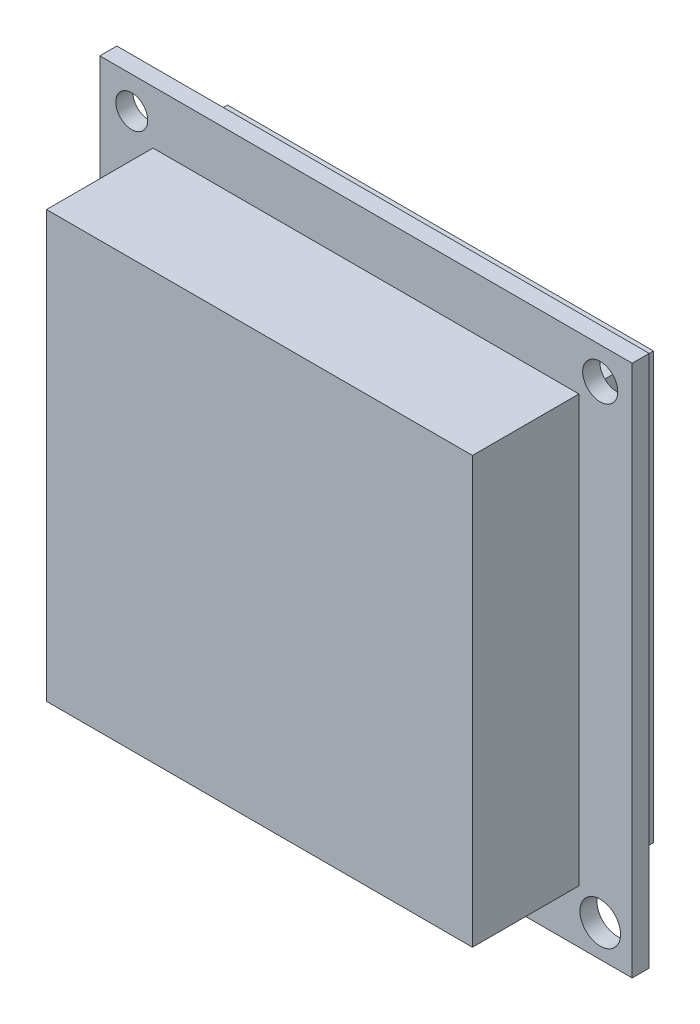
from build123d import *

# Parameters (mm, degrees)
SKETCH1_W           = 50
SKETCH1_H           = 50
SKETCH1_R           = 1.5
SKETCH1_R_2         = 1.646935024
SKETCH1_R_3         = 1.908192471
SKETCH1_R_4         = 1.759080553
EXTRUDE2_DEPTH      = 0.8
EXTRUDE3_DEPTH      = 10
EXTRUDE3_DEPTH_BACK = 7


with BuildPart() as part:
    # Sketch1 → Extrude2 (new, symmetric)
    with BuildSketch(Plane.XY):
        Rectangle(SKETCH1_W, SKETCH1_H)
        with Locations((-22, 22)):
            Circle(SKETCH1_R, mode=Mode.SUBTRACT)
        with Locations((22, 22)):
            Circle(SKETCH1_R_2, mode=Mode.SUBTRACT)
        with Locations((22, -22)):
            Circle(SKETCH1_R_3, mode=Mode.SUBTRACT)
        with Locations((-22, -22)):
            Circle(SKETCH1_R_4, mode=Mode.SUBTRACT)
    extrude(amount=EXTRUDE2_DEPTH, both=True)

    # Sketch2 → Extrude3 (add, two sides: drawn at the far end of the back side and taken through both)
    with BuildSketch(Plane.XY.offset(0.8).offset(-EXTRUDE3_DEPTH_BACK)):
        Polygon((-20, 20), (20, -20), (-20, -20), align=None)
        Polygon((-20, 20), (20, 20), (20, -20), align=None)
    extrude(amount=EXTRUDE3_DEPTH + EXTRUDE3_DEPTH_BACK)


solid = part.part
